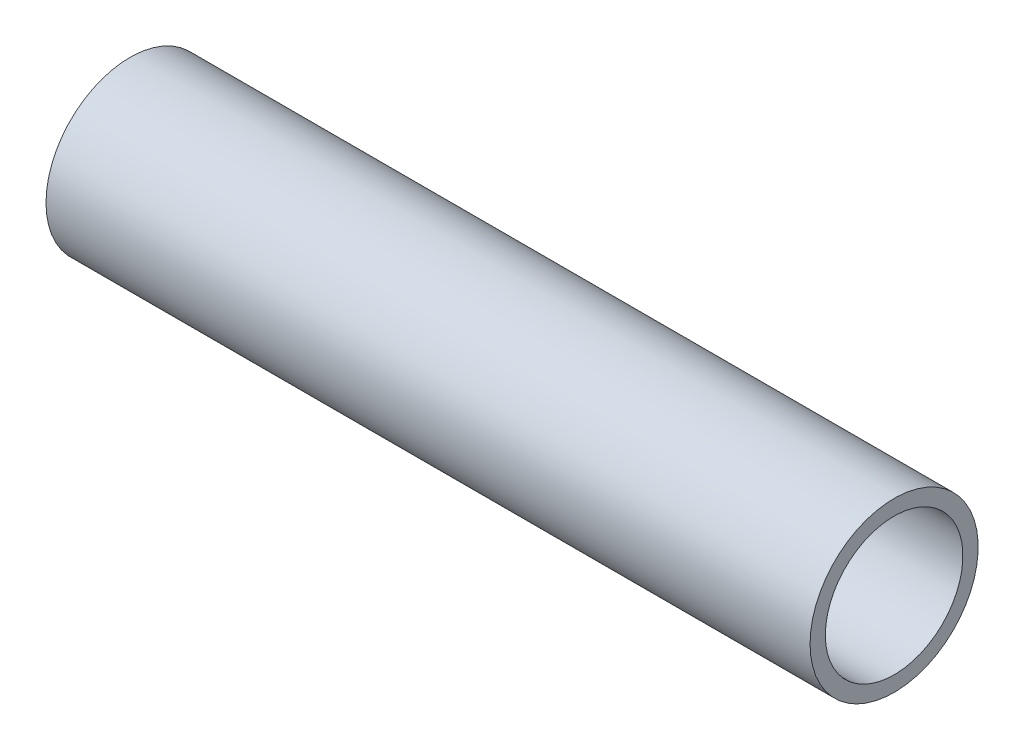
from build123d import *

# Parameters (mm, degrees)
SKETCH1_W = 250
SKETCH1_H = 5


with BuildPart() as part:
    # Sketch1 → Revolve1 (revolve)
    with BuildSketch(Plane(origin=(0, 0, 0), x_dir=(1, 0, 0), z_dir=(0, 1, 0)), mode=Mode.PRIVATE) as revolve1_sk:
        with Locations((-125, 2.5)):
            Rectangle(SKETCH1_W, SKETCH1_H)
    revolve(revolve1_sk.sketch.rotate(Axis((-250, 0, 22.5), (1, 0, 0)), 180), axis=Axis((-250, 0, 22.5), (1, 0, 0)))


solid = part.part
